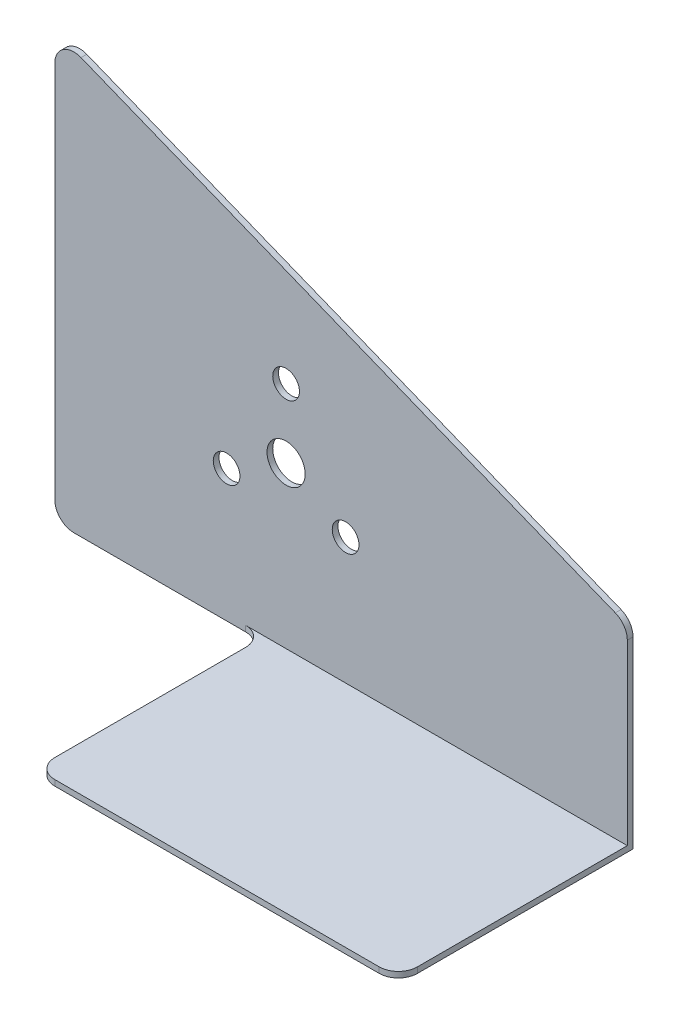
from build123d import *

# Parameters (mm, degrees)
SKETCH1_W           = 190
SKETCH1_H           = 3
EXTRUDE_THIN1_DEPTH = 120
BOSS_EXTRUDE1_DEPTH = 3
FILLET2_R           = 10
SKETCH4_R           = 7
SKETCH4_R_2         = 10
CUT_EXTRUDE1_DEPTH  = 3


with BuildPart() as part:
    # Sketch1 → Extrude-Thin1 (new body)
    with BuildSketch(Plane.XY):
        with Locations((95, -1.5)):
            Rectangle(SKETCH1_W, SKETCH1_H)
    extrude(amount=EXTRUDE_THIN1_DEPTH)

    # Sketch3 → Boss-Extrude1 (add)
    with BuildSketch(Plane(origin=(0, 0, 0), x_dir=(-1, 0, 0), z_dir=(0, 0, -1))):
        Polygon((-190, 0), (-190, 100), (110, 220), (110, 0), (110, -3), (-190, -3), align=None)
    extrude(amount=BOSS_EXTRUDE1_DEPTH)

    # Fillet2
    fillet2_edges = [part.edges().sort_by_distance(p)[0] for p in [
        (0, -1.5, 120),
        (-110, -3, -1.5),
        (-110, 220, -1.5),
        (190, 100, -1.5),
        (0, -1.5, 0),
        (190, -1.5, 120),
    ]]
    fillet(fillet2_edges, radius=FILLET2_R)

    # Sketch4 → Cut-Extrude1 (cut)
    with BuildSketch(Plane(origin=(0, 0, -3), x_dir=(-1, 0, 0), z_dir=(0, 0, -1))):
        with Locations((-42.372187551, 66.2)):
            Circle(SKETCH4_R)
        with Locations((19.981641522, 66.2)):
            Circle(SKETCH4_R)
        with Locations((-11.195273015, 120.2)):
            Circle(SKETCH4_R)
        with Locations((-11.195273015, 84.2)):
            Circle(SKETCH4_R_2)
    extrude(amount=-CUT_EXTRUDE1_DEPTH, mode=Mode.SUBTRACT)


solid = part.part
